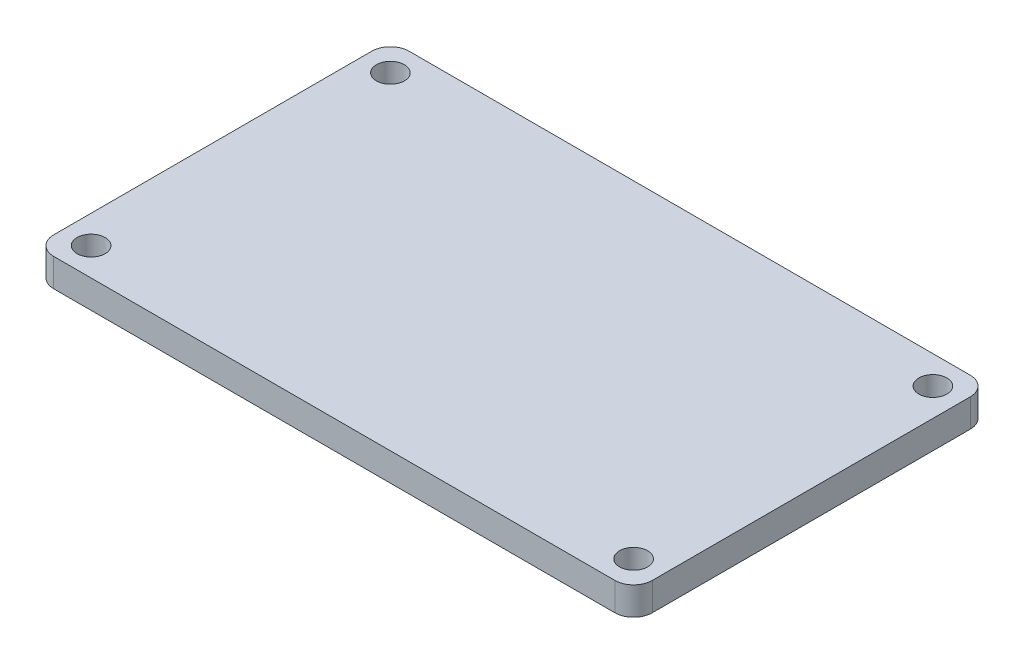
from build123d import *

# Parameters (mm, degrees)
SKETCH1_R           = 1.5
BOSS_EXTRUDE1_DEPTH = 3


with BuildPart() as part:
    # Sketch1 → Boss-Extrude1 (new body)
    with BuildSketch(Plane(origin=(0, 0, 0), x_dir=(1, 0, 0), z_dir=(0, 1, 0))):
        with BuildLine():
            Line((-30, -19), (30, -19))
            ThreePointArc((30, -19), (31.414213562, -18.414213562), (32, -17))
            Line((32, -17), (32, 17))
            ThreePointArc((32, 17), (31.414213562, 18.414213562), (30, 19))
            Line((30, 19), (-30, 19))
            ThreePointArc((-30, 19), (-31.414213562, 18.414213562), (-32, 17))
            Line((-32, 17), (-32, -17))
            ThreePointArc((-32, -17), (-31.414213562, -18.414213562), (-30, -19))
        make_face()
        with Locations(Location((-29, 16, 0), (0, 0, 270))):
            Circle(SKETCH1_R, mode=Mode.SUBTRACT)
        with Locations(Location((29, 16, 0), (0, 0, 270))):
            Circle(SKETCH1_R, mode=Mode.SUBTRACT)
        with Locations(Location((-29, -16, 0), (0, 0, 270))):
            Circle(SKETCH1_R, mode=Mode.SUBTRACT)
        with Locations(Location((29, -16, 0), (0, 0, 270))):
            Circle(SKETCH1_R, mode=Mode.SUBTRACT)
    extrude(amount=BOSS_EXTRUDE1_DEPTH)


solid = part.part
